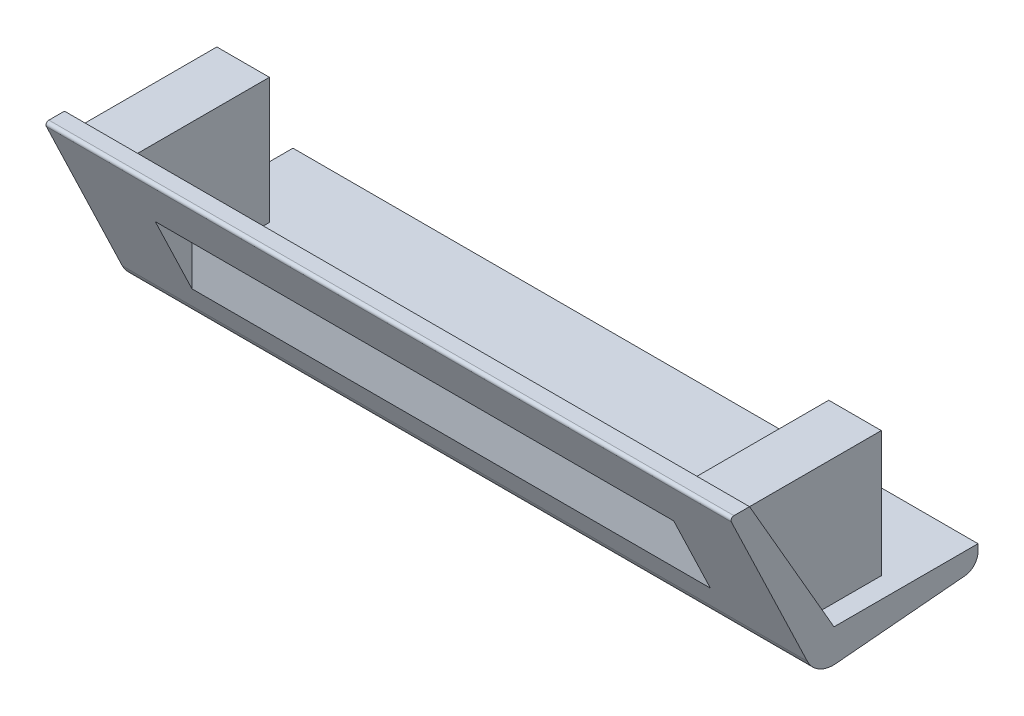
from build123d import *

# Parameters (mm, degrees)
BOSS_EXTRUDE2_DEPTH             = 118.925
BOSS_EXTRUDE1_REACH             = 140.65
SKETCH2_W                       = 18.25
SKETCH2_H                       = 43.65
BOSS_EXTRUDE1_DIRECTION_2_DEPTH = 20
CUT_EXTRUDE2_DEPTH              = 90
FILLET1_R                       = 10
FILLET2_R                       = 5
FILLET3_R                       = 1


with BuildPart() as part:
    # Sketch1 → Boss-Extrude2 (new, symmetric)
    with BuildSketch(Plane(origin=(0, 0, 0), x_dir=(0, 0, -1), z_dir=(1, 0, 0))):
        Polygon((0, 0), (-29.329393675, 50.8), (-36.329393675, 50.8), (-6.252899132, -12), (50, -7), (50, 0), align=None)
    extrude(amount=BOSS_EXTRUDE2_DEPTH, both=True)

    # Boss-Extrude1: up to this plane
    boss_extrude1_end = Plane(origin=(118.925, 0, 0), z_dir=(0, -0.5000000000000043, 0.8660254037844363))
    # Sketch2 → Boss-Extrude1 (add, up to the surface)
    with BuildSketch(Plane.XY, mode=Mode.PRIVATE) as boss_extrude1_sk1:
        with Locations((106.225, 25.4)):
            Rectangle(SKETCH2_W, SKETCH2_H)
    boss_extrude1_tool1 = split(extrude(boss_extrude1_sk1.sketch, amount=BOSS_EXTRUDE1_REACH, mode=Mode.PRIVATE), bisect_by=boss_extrude1_end, keep=Keep.BOTH, mode=Mode.PRIVATE)
    add(boss_extrude1_tool1.solids().sort_by_distance((106.225, 25.4, 0))[0])
    # Sketch2 → Boss-Extrude1 (add, up to the surface)
    with BuildSketch(Plane.XY, mode=Mode.PRIVATE) as boss_extrude1_sk2:
        with Locations((-106.225, 25.4)):
            Rectangle(SKETCH2_W, SKETCH2_H)
    boss_extrude1_tool2 = split(extrude(boss_extrude1_sk2.sketch, amount=BOSS_EXTRUDE1_REACH, mode=Mode.PRIVATE), bisect_by=boss_extrude1_end, keep=Keep.BOTH, mode=Mode.PRIVATE)
    add(boss_extrude1_tool2.solids().sort_by_distance((-106.225, 25.4, 0))[0])

    # Sketch2 → Boss-Extrude1 direction 2 (add)
    with BuildSketch(Plane.XY):
        with Locations((106.225, 25.4)):
            Rectangle(SKETCH2_W, SKETCH2_H)
        with Locations((-106.225, 25.4)):
            Rectangle(SKETCH2_W, SKETCH2_H)
    extrude(amount=-BOSS_EXTRUDE1_DIRECTION_2_DEPTH)

    # Sketch4 → Cut-Extrude2 (cut, symmetric)
    with BuildSketch(Plane(origin=(0, 0, 0), x_dir=(0, 0, -1), z_dir=(1, 0, 0))):
        Polygon((-26.729651832, 30.755649855), (-20, 34.641016151), (-14, 24.248711306), (-14, 4.176018579), align=None)
    extrude(amount=CUT_EXTRUDE2_DEPTH, both=True, mode=Mode.SUBTRACT)

    # Fillet1
    fillet1_edges = [part.edges().sort_by_distance(p)[0] for p in [
        (0, -12, 6.252899132),
    ]]
    fillet(fillet1_edges, radius=FILLET1_R)

    # Fillet2
    fillet2_edges = [part.edges().sort_by_distance(p)[0] for p in [
        (0, -7, -50),
    ]]
    fillet(fillet2_edges, radius=FILLET2_R)

    # Fillet3
    fillet3_edges = [part.edges().sort_by_distance(p)[0] for p in [
        (0, 50.8, 36.329393675),
    ]]
    fillet(fillet3_edges, radius=FILLET3_R)


solid = part.part
